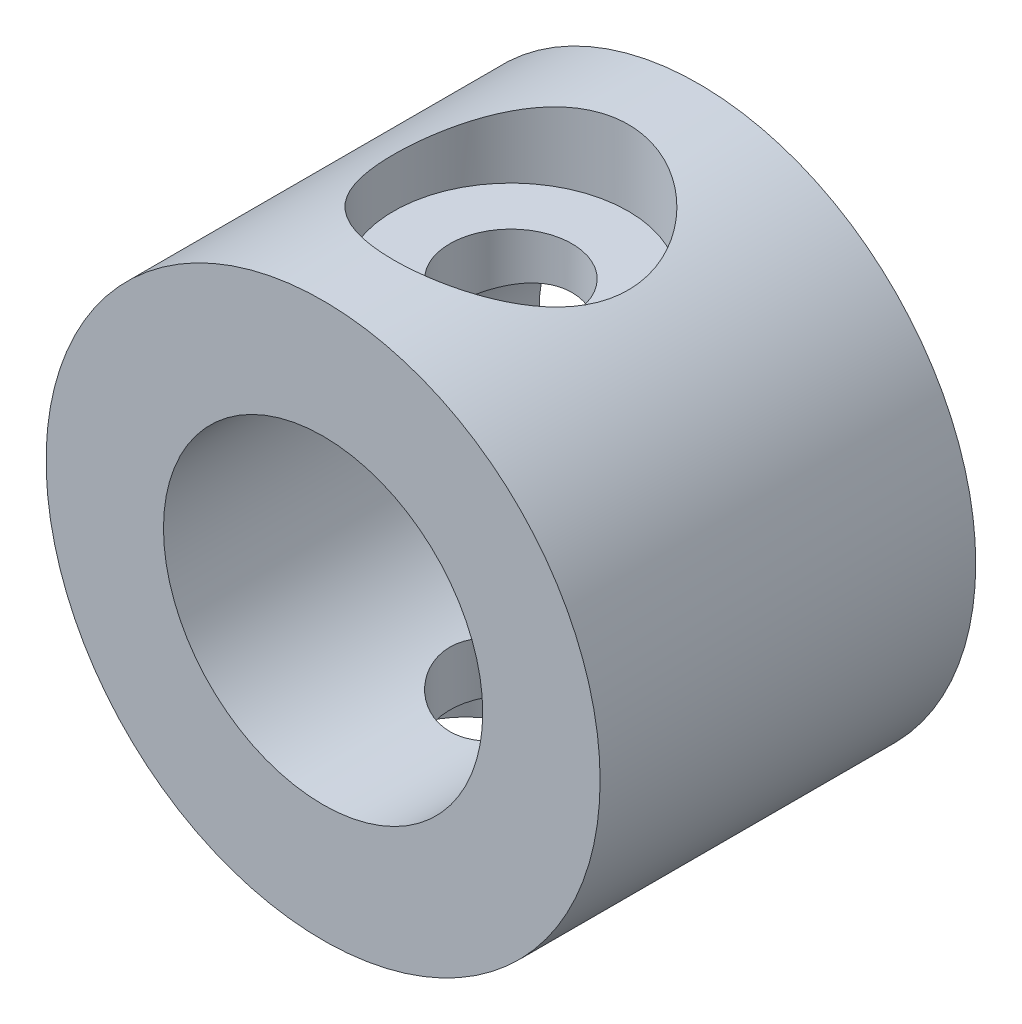
from build123d import *

# Parameters (mm, degrees)
SKETCH_1_R               = 5.9
SKETCH_1_R_2             = 3.4
EXTRUDE_1_DEPTH          = 8
PATTERN_CIRCULAR_1_COUNT = 2


with BuildPart() as part:
    # 스케치1 → 보스-돌출1 (new body)
    with BuildSketch(Plane.XY):
        Circle(SKETCH_1_R)
        Circle(SKETCH_1_R_2, mode=Mode.SUBTRACT)
    extrude(amount=EXTRUDE_1_DEPTH)

    # 스케치6 → M2 남비 머리 나사용 카운터보어3 (revolve, cut)
    with BuildSketch(Plane(origin=(0, 5.9, 4), x_dir=(0, 0, 1), z_dir=(1, 0, 0))):
        Polygon((0, 0), (0, 5.781118805), (1.3, 5), (1.3, 1.6), (2.5, 1.6), (2.5, 0), align=None)
    hole_wizard_m2_3 = revolve(axis=Axis((0, 12.25, 4), (0, -1, 0)), mode=Mode.SUBTRACT)

    # 원형 패턴1: M2 남비 머리 나사용 카운터보어3 ×2 about axis
    pattern_circular_1_axis = Axis((0, 0, 8), (0, 0, 1))
    for i in range(1, PATTERN_CIRCULAR_1_COUNT):
        add(hole_wizard_m2_3.rotate(pattern_circular_1_axis, i * 360 / PATTERN_CIRCULAR_1_COUNT), mode=Mode.SUBTRACT)


solid = part.part
